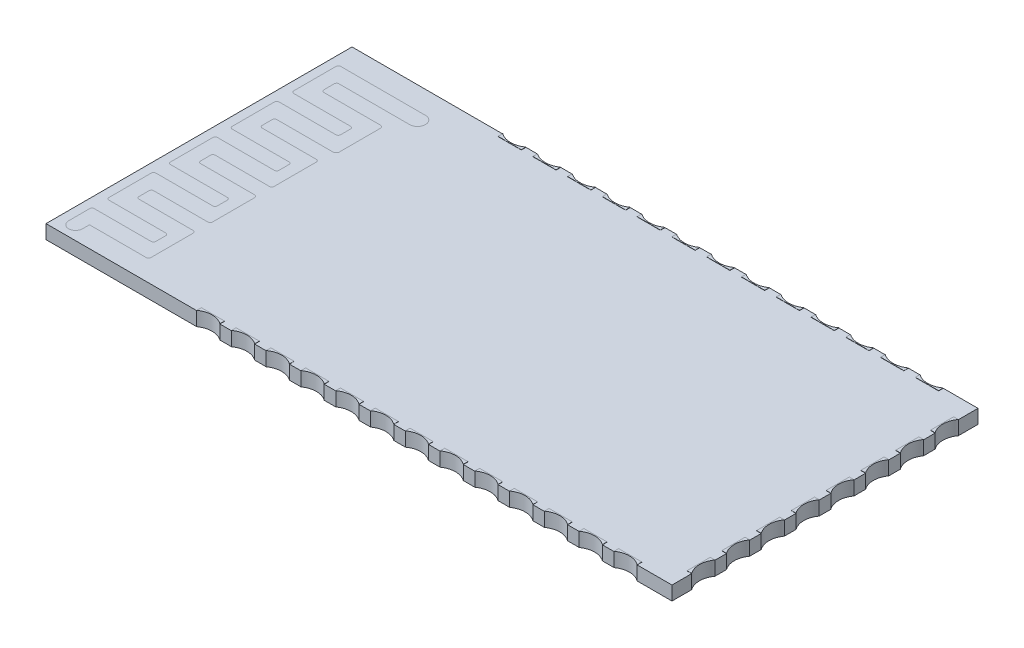
from build123d import *

# Parameters (mm, degrees)
SKETCH1_W           = 27
SKETCH1_H           = 13.2
BOSS_EXTRUDE1_DEPTH = 0.6
SKETCH3_W           = 1
SKETCH3_H           = 0.2
SKETCH3_W_2         = 0.2
SKETCH3_H_2         = 1
BOSS_EXTRUDE2_DEPTH = 0.01
CUT_EXTRUDE1_DEPTH  = 16.039351715


with BuildPart() as part:
    # Sketch1 → Boss-Extrude1 (new body)
    with BuildSketch(Plane(origin=(0, 0, 0), x_dir=(1, 0, 0), z_dir=(0, 1, 0))):
        Rectangle(SKETCH1_W, SKETCH1_H)
    extrude(amount=BOSS_EXTRUDE1_DEPTH)

    # Sketch3 → Boss-Extrude2 (add)
    with BuildSketch(Plane(origin=(0, 0.6, 0), x_dir=(1, 0, 0), z_dir=(0, 1, 0))):
        with Locations((-6.5, 6.5)):
            Rectangle(SKETCH3_W, SKETCH3_H)
        with Locations((-5, 6.5)):
            Rectangle(SKETCH3_W, SKETCH3_H)
        with Locations((-3.5, 6.5)):
            Rectangle(SKETCH3_W, SKETCH3_H)
        with Locations((-2, 6.5)):
            Rectangle(SKETCH3_W, SKETCH3_H)
        with Locations((-0.5, 6.5)):
            Rectangle(SKETCH3_W, SKETCH3_H)
        with Locations((1, 6.5)):
            Rectangle(SKETCH3_W, SKETCH3_H)
        with Locations((2.5, 6.5)):
            Rectangle(SKETCH3_W, SKETCH3_H)
        with Locations((4, 6.5)):
            Rectangle(SKETCH3_W, SKETCH3_H)
        with Locations((5.5, 6.5)):
            Rectangle(SKETCH3_W, SKETCH3_H)
        with Locations((7, 6.5)):
            Rectangle(SKETCH3_W, SKETCH3_H)
        with Locations((8.5, 6.5)):
            Rectangle(SKETCH3_W, SKETCH3_H)
        with Locations((10, 6.5)):
            Rectangle(SKETCH3_W, SKETCH3_H)
        with Locations((11.5, 6.5)):
            Rectangle(SKETCH3_W, SKETCH3_H)
        with Locations((13.4, 5.25)):
            Rectangle(SKETCH3_W_2, SKETCH3_H_2)
        with Locations((13.4, 3.75)):
            Rectangle(SKETCH3_W_2, SKETCH3_H_2)
        with Locations((13.4, 2.25)):
            Rectangle(SKETCH3_W_2, SKETCH3_H_2)
        with Locations((13.4, 0.75)):
            Rectangle(SKETCH3_W_2, SKETCH3_H_2)
        with Locations((13.4, -0.75)):
            Rectangle(SKETCH3_W_2, SKETCH3_H_2)
        with Locations((13.4, -2.25)):
            Rectangle(SKETCH3_W_2, SKETCH3_H_2)
        with Locations((13.4, -3.75)):
            Rectangle(SKETCH3_W_2, SKETCH3_H_2)
        with Locations((13.4, -5.25)):
            Rectangle(SKETCH3_W_2, SKETCH3_H_2)
        with Locations((11.5, -6.5)):
            Rectangle(SKETCH3_W, SKETCH3_H)
        with Locations((10, -6.5)):
            Rectangle(SKETCH3_W, SKETCH3_H)
        with Locations((8.5, -6.5)):
            Rectangle(SKETCH3_W, SKETCH3_H)
        with Locations((7, -6.5)):
            Rectangle(SKETCH3_W, SKETCH3_H)
        with Locations((5.5, -6.5)):
            Rectangle(SKETCH3_W, SKETCH3_H)
        with Locations((4, -6.5)):
            Rectangle(SKETCH3_W, SKETCH3_H)
        with Locations((2.5, -6.5)):
            Rectangle(SKETCH3_W, SKETCH3_H)
        with Locations((1, -6.5)):
            Rectangle(SKETCH3_W, SKETCH3_H)
        with Locations((-0.5, -6.5)):
            Rectangle(SKETCH3_W, SKETCH3_H)
        with Locations((-2, -6.5)):
            Rectangle(SKETCH3_W, SKETCH3_H)
        with Locations((-3.5, -6.5)):
            Rectangle(SKETCH3_W, SKETCH3_H)
        with Locations((-5, -6.5)):
            Rectangle(SKETCH3_W, SKETCH3_H)
        with Locations((-6.5, -6.5)):
            Rectangle(SKETCH3_W, SKETCH3_H)
    extrude(amount=BOSS_EXTRUDE2_DEPTH)

    # Sketch4 → Cut-Extrude1 (cut, through all)
    with BuildSketch(Plane(origin=(0, 0.61, 0), x_dir=(1, 0, 0), z_dir=(0, 1, 0))):
        with BuildLine():
            Line((-7, 6.6), (-6, 6.6))
            ThreePointArc((-6, 6.6), (-6.5, 6.437386354), (-7, 6.6))
        make_face()
        with BuildLine():
            Line((-5.5, 6.6), (-4.5, 6.6))
            ThreePointArc((-4.5, 6.6), (-5, 6.437386354), (-5.5, 6.6))
        make_face()
        with BuildLine():
            Line((-4, 6.6), (-3, 6.6))
            ThreePointArc((-3, 6.6), (-3.5, 6.437386354), (-4, 6.6))
        make_face()
        with BuildLine():
            Line((-2.5, 6.6), (-1.5, 6.6))
            ThreePointArc((-1.5, 6.6), (-2, 6.437386354), (-2.5, 6.6))
        make_face()
        with BuildLine():
            Line((-1, 6.6), (0, 6.6))
            ThreePointArc((0, 6.6), (-0.5, 6.437386354), (-1, 6.6))
        make_face()
        with BuildLine():
            Line((0.5, 6.6), (1.5, 6.6))
            ThreePointArc((1.5, 6.6), (1, 6.437386354), (0.5, 6.6))
        make_face()
        with BuildLine():
            Line((2, 6.6), (3, 6.6))
            ThreePointArc((3, 6.6), (2.5, 6.437386354), (2, 6.6))
        make_face()
        with BuildLine():
            Line((3.5, 6.6), (4.5, 6.6))
            ThreePointArc((4.5, 6.6), (4, 6.437386354), (3.5, 6.6))
        make_face()
        with BuildLine():
            Line((5, 6.6), (6, 6.6))
            ThreePointArc((6, 6.6), (5.5, 6.437386354), (5, 6.6))
        make_face()
        with BuildLine():
            Line((6.5, 6.6), (7.5, 6.6))
            ThreePointArc((7.5, 6.6), (7, 6.437386354), (6.5, 6.6))
        make_face()
        with BuildLine():
            Line((8, 6.6), (9, 6.6))
            ThreePointArc((9, 6.6), (8.5, 6.437386354), (8, 6.6))
        make_face()
        with BuildLine():
            Line((9.5, 6.6), (10.5, 6.6))
            ThreePointArc((10.5, 6.6), (10, 6.437386354), (9.5, 6.6))
        make_face()
        with BuildLine():
            Line((11, 6.6), (12, 6.6))
            ThreePointArc((12, 6.6), (11.5, 6.437386354), (11, 6.6))
        make_face()
        with BuildLine():
            Line((13.5, 5.75), (13.5, 4.75))
            ThreePointArc((13.5, 4.75), (13.337386354, 5.25), (13.5, 5.75))
        make_face()
        with BuildLine():
            Line((13.5, 4.25), (13.5, 3.25))
            ThreePointArc((13.5, 3.25), (13.337386354, 3.75), (13.5, 4.25))
        make_face()
        with BuildLine():
            Line((13.5, 2.75), (13.5, 1.75))
            ThreePointArc((13.5, 1.75), (13.337386354, 2.25), (13.5, 2.75))
        make_face()
        with BuildLine():
            Line((13.5, 1.25), (13.5, 0.25))
            ThreePointArc((13.5, 0.25), (13.337386354, 0.75), (13.5, 1.25))
        make_face()
        with BuildLine():
            Line((13.5, -0.25), (13.5, -1.25))
            ThreePointArc((13.5, -1.25), (13.337386354, -0.75), (13.5, -0.25))
        make_face()
        with BuildLine():
            Line((13.5, -1.75), (13.5, -2.75))
            ThreePointArc((13.5, -2.75), (13.337386354, -2.25), (13.5, -1.75))
        make_face()
        with BuildLine():
            Line((13.5, -3.25), (13.5, -4.25))
            ThreePointArc((13.5, -4.25), (13.337386354, -3.75), (13.5, -3.25))
        make_face()
        with BuildLine():
            Line((13.5, -4.75), (13.5, -5.75))
            ThreePointArc((13.5, -5.75), (13.337386354, -5.25), (13.5, -4.75))
        make_face()
        with BuildLine():
            Line((11, -6.6), (12, -6.6))
            ThreePointArc((12, -6.6), (11.5, -6.437386354), (11, -6.6))
        make_face()
        with BuildLine():
            Line((9.5, -6.6), (10.5, -6.6))
            ThreePointArc((10.5, -6.6), (10, -6.437386354), (9.5, -6.6))
        make_face()
        with BuildLine():
            Line((8, -6.6), (9, -6.6))
            ThreePointArc((9, -6.6), (8.5, -6.437386354), (8, -6.6))
        make_face()
        with BuildLine():
            Line((6.5, -6.6), (7.5, -6.6))
            ThreePointArc((7.5, -6.6), (7, -6.437386354), (6.5, -6.6))
        make_face()
        with BuildLine():
            Line((5, -6.6), (6, -6.6))
            ThreePointArc((6, -6.6), (5.5, -6.437386354), (5, -6.6))
        make_face()
        with BuildLine():
            Line((3.5, -6.6), (4.5, -6.6))
            ThreePointArc((4.5, -6.6), (4, -6.437386354), (3.5, -6.6))
        make_face()
        with BuildLine():
            Line((2, -6.6), (3, -6.6))
            ThreePointArc((3, -6.6), (2.5, -6.437386354), (2, -6.6))
        make_face()
        with BuildLine():
            Line((0.5, -6.6), (1.5, -6.6))
            ThreePointArc((1.5, -6.6), (1, -6.437386354), (0.5, -6.6))
        make_face()
        with BuildLine():
            Line((-1, -6.6), (0, -6.6))
            ThreePointArc((0, -6.6), (-0.5, -6.437386354), (-1, -6.6))
        make_face()
        with BuildLine():
            Line((-2.5, -6.6), (-1.5, -6.6))
            ThreePointArc((-1.5, -6.6), (-2, -6.437386354), (-2.5, -6.6))
        make_face()
        with BuildLine():
            Line((-4, -6.6), (-3, -6.6))
            ThreePointArc((-3, -6.6), (-3.5, -6.437386354), (-4, -6.6))
        make_face()
        with BuildLine():
            Line((-5.5, -6.6), (-4.5, -6.6))
            ThreePointArc((-4.5, -6.6), (-5, -6.437386354), (-5.5, -6.6))
        make_face()
        with BuildLine():
            Line((-7, -6.6), (-6, -6.6))
            ThreePointArc((-6, -6.6), (-6.5, -6.437386354), (-7, -6.6))
        make_face()
    extrude(amount=-CUT_EXTRUDE1_DEPTH, mode=Mode.SUBTRACT)


solid = part.part
